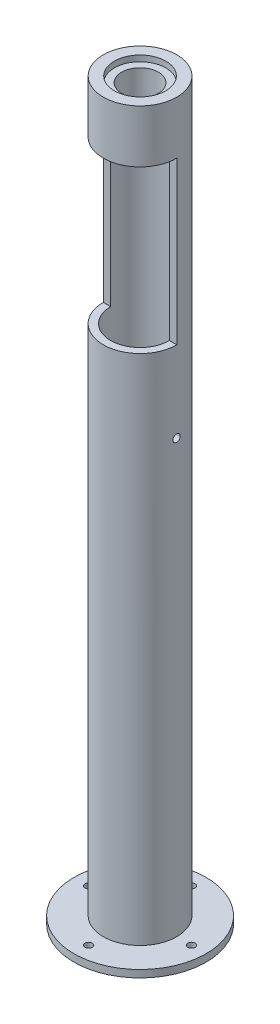
from build123d import *

# Parameters (mm, degrees)
SKETCH2_R          = 2.5
SKETCH2_W          = 30
SKETCH2_H          = 110
CUT_EXTRUDE1_DEPTH = 507.87769728
SKETCH3_R          = 1.5
CUT_EXTRUDE2_DEPTH = 476.279917621
CUT_EXTRUDE3_REACH = 501.074
SKETCH4_R          = 2.5


with BuildPart() as part:
    # Sketch1 → Revolve1 (revolve)
    with BuildSketch(Plane.XY, mode=Mode.PRIVATE) as revolve1_sk:
        Polygon((20, 0), (45, 0), (45, 5), (25, 5), (25, 500), (17.5, 500), (17.5, 496), (12.5, 496), (12.5, 471), (6, 471), (6, 464), (20, 464), align=None)
    revolve(revolve1_sk.sketch.rotate(Axis((0, 0, 0), (0, 1, 0)), 90), axis=Axis((0, 0, 0), (0, 1, 0)))

    # Sketch2 → Cut-Extrude1 (cut, through all)
    with BuildSketch(Plane.ZY.offset(25)):
        with Locations((0, 299)):
            Circle(SKETCH2_R)
        with Locations((15, 409)):
            Rectangle(SKETCH2_W, SKETCH2_H)
    extrude(amount=-CUT_EXTRUDE1_DEPTH, mode=Mode.SUBTRACT)

    # Sketch3 → Cut-Extrude2 (cut, through all)
    with BuildSketch(Plane(origin=(0, 471, 0), x_dir=(1, 0, 0), z_dir=(0, 1, 0))):
        with Locations(Location((-8.090824797, 5.99528599, 0), (0, 0, 270))):
            Circle(SKETCH3_R)
        with Locations(Location((7.409175203, 6.819752401, 0), (0, 0, 270))):
            Circle(SKETCH3_R)
    extrude(amount=-CUT_EXTRUDE2_DEPTH, mode=Mode.SUBTRACT)

    # Sketch4 → Cut-Extrude3 (cut, up to next)
    with BuildSketch(Plane(origin=(0, 5, 0), x_dir=(1, 0, 0), z_dir=(0, 1, 0)), mode=Mode.PRIVATE) as cut_extrude3_sk1:
        with Locations(Location((0, 35, 0), (0, 0, 270))):
            Circle(SKETCH4_R)
    cut_extrude3_tool1 = extrude(cut_extrude3_sk1.sketch, amount=-CUT_EXTRUDE3_REACH, mode=Mode.PRIVATE) & part.part
    # Sketch4 → Cut-Extrude3 (cut, up to next)
    with BuildSketch(Plane(origin=(0, 5, 0), x_dir=(1, 0, 0), z_dir=(0, 1, 0)), mode=Mode.PRIVATE) as cut_extrude3_sk2:
        with Locations(Location((35, 0, 0), (0, 0, 270))):
            Circle(SKETCH4_R)
    cut_extrude3_tool2 = extrude(cut_extrude3_sk2.sketch, amount=-CUT_EXTRUDE3_REACH, mode=Mode.PRIVATE) & part.part
    # Sketch4 → Cut-Extrude3 (cut, up to next)
    with BuildSketch(Plane(origin=(0, 5, 0), x_dir=(1, 0, 0), z_dir=(0, 1, 0)), mode=Mode.PRIVATE) as cut_extrude3_sk3:
        with Locations(Location((0, -35, 0), (0, 0, 270))):
            Circle(SKETCH4_R)
    cut_extrude3_tool3 = extrude(cut_extrude3_sk3.sketch, amount=-CUT_EXTRUDE3_REACH, mode=Mode.PRIVATE) & part.part
    # Sketch4 → Cut-Extrude3 (cut, up to next)
    with BuildSketch(Plane(origin=(0, 5, 0), x_dir=(1, 0, 0), z_dir=(0, 1, 0)), mode=Mode.PRIVATE) as cut_extrude3_sk4:
        with Locations(Location((-35, 0, 0), (0, 0, 270))):
            Circle(SKETCH4_R)
    cut_extrude3_tool4 = extrude(cut_extrude3_sk4.sketch, amount=-CUT_EXTRUDE3_REACH, mode=Mode.PRIVATE) & part.part
    add(cut_extrude3_tool1.solids().sort_by_distance((0, 5, -35))[0], mode=Mode.SUBTRACT)
    add(cut_extrude3_tool2.solids().sort_by_distance((35, 5, 0))[0], mode=Mode.SUBTRACT)
    add(cut_extrude3_tool3.solids().sort_by_distance((0, 5, 35))[0], mode=Mode.SUBTRACT)
    add(cut_extrude3_tool4.solids().sort_by_distance((-35, 5, 0))[0], mode=Mode.SUBTRACT)


solid = part.part
